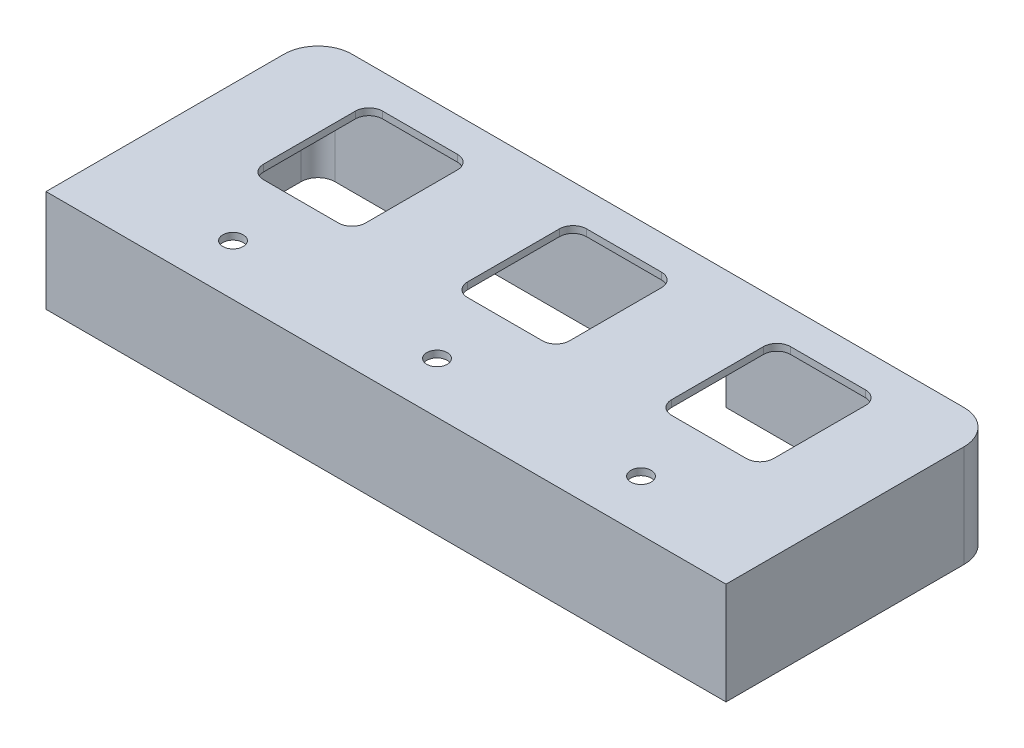
from build123d import *

# Parameters (mm, degrees)
SKETCH_1131_R          = 3
EXTRUDE_1145_DEPTH     = 2
EXTRUDE_1198_DEPTH     = 30
SKETCH_1301_W          = 30
SKETCH_1301_H          = 5
CUT_EXTRUDE_1405_DEPTH = 10


with BuildPart() as part:
    # Sketch 1131 → Extrude 1145 (new body)
    with BuildSketch(Plane(origin=(0, 0, 0), x_dir=(1, 0, 0), z_dir=(0, 1, 0))):
        with BuildLine():
            Line((-90, 40), (90, 40))
            ThreePointArc((90, 40), (97.071067812, 37.071067812), (100, 30))
            Line((100, 30), (100, -40))
            Line((100, -40), (-100, -40))
            Line((-100, -40), (-100, 30))
            ThreePointArc((-100, 30), (-97.071067812, 37.071067812), (-90, 40))
        make_face()
        with Locations(Location((60, -25, 0), (0, 0, 270))):
            Circle(SKETCH_1131_R, mode=Mode.SUBTRACT)
        with Locations(Location((0, -25, 0), (0, 0, 270))):
            Circle(SKETCH_1131_R, mode=Mode.SUBTRACT)
        with Locations(Location((-60, -25, 0), (0, 0, 270))):
            Circle(SKETCH_1131_R, mode=Mode.SUBTRACT)
        with BuildLine():
            Line((49, 30), (71, 30))
            ThreePointArc((71, 30), (73.828427125, 28.828427125), (75, 26))
            Line((75, 26), (75, -1))
            ThreePointArc((75, -1), (73.828427125, -3.828427125), (71, -5))
            Line((71, -5), (49, -5))
            ThreePointArc((49, -5), (46.171572875, -3.828427125), (45, -1))
            Line((45, -1), (45, 26))
            ThreePointArc((45, 26), (46.171572875, 28.828427125), (49, 30))
        make_face(mode=Mode.SUBTRACT)
        with BuildLine():
            Line((-11, 30), (11, 30))
            ThreePointArc((11, 30), (13.828427125, 28.828427125), (15, 26))
            Line((15, 26), (15, -1))
            ThreePointArc((15, -1), (13.828427125, -3.828427125), (11, -5))
            Line((11, -5), (-11, -5))
            ThreePointArc((-11, -5), (-13.828427125, -3.828427125), (-15, -1))
            Line((-15, -1), (-15, 26))
            ThreePointArc((-15, 26), (-13.828427125, 28.828427125), (-11, 30))
        make_face(mode=Mode.SUBTRACT)
        with BuildLine():
            Line((-71, 30), (-49, 30))
            ThreePointArc((-49, 30), (-46.171572875, 28.828427125), (-45, 26))
            Line((-45, 26), (-45, -1))
            ThreePointArc((-45, -1), (-46.171572875, -3.828427125), (-49, -5))
            Line((-49, -5), (-71, -5))
            ThreePointArc((-71, -5), (-73.828427125, -3.828427125), (-75, -1))
            Line((-75, -1), (-75, 26))
            ThreePointArc((-75, 26), (-73.828427125, 28.828427125), (-71, 30))
        make_face(mode=Mode.SUBTRACT)
    extrude(amount=-EXTRUDE_1145_DEPTH)

    # Sketch 1191 → Extrude 1198 (add)
    with BuildSketch(Plane(origin=(0, 0, 0), x_dir=(1, 0, 0), z_dir=(0, 1, 0))):
        with BuildLine():
            Line((-90, 40), (90, 40))
            ThreePointArc((90, 40), (97.071067812, 37.071067812), (100, 30))
            Line((100, 30), (100, -40))
            Line((100, -40), (-100, -40))
            Line((-100, -40), (-100, 30))
            ThreePointArc((-100, 30), (-97.071067812, 37.071067812), (-90, 40))
        make_face()
        with BuildLine():
            Line((-90, 35), (90, 35))
            ThreePointArc((90, 35), (93.535533906, 33.535533906), (95, 30))
            Line((95, 30), (95, -35))
            Line((95, -35), (-95, -35))
            Line((-95, -35), (-95, 30))
            ThreePointArc((-95, 30), (-93.535533906, 33.535533906), (-90, 35))
        make_face(mode=Mode.SUBTRACT)
    extrude(amount=-EXTRUDE_1198_DEPTH)

    # Sketch 1301 → Cut-Extrude 1405 (cut)
    with BuildSketch(Plane(origin=(0, -30, 0), x_dir=(1, 0, 0), z_dir=(0, 1, 0))):
        with Locations((10, 37.5)):
            Rectangle(SKETCH_1301_W, SKETCH_1301_H)
    extrude(amount=CUT_EXTRUDE_1405_DEPTH, mode=Mode.SUBTRACT)


solid = part.part
